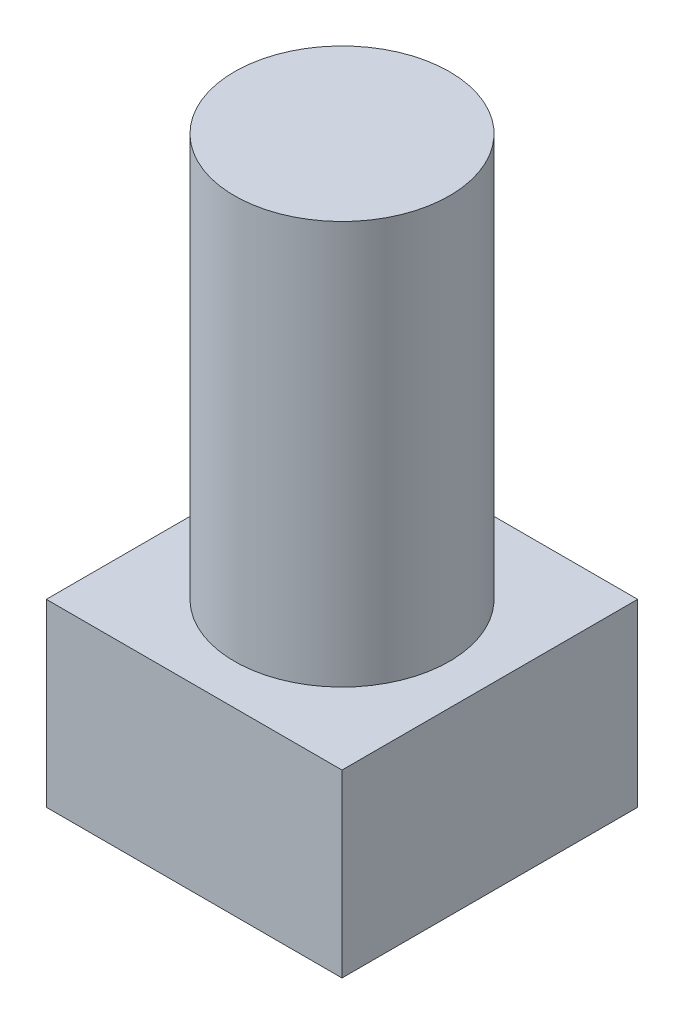
from build123d import *

# Parameters (mm, degrees)
ESQUISSE2_OUTSIDE_W     = 24.27
ESQUISSE2_OUTSIDE_H     = 24.27
ESQUISSE2_OUTSIDE_W_2   = 11
ESQUISSE2_OUTSIDE_H_2   = 11
ENL_V_MAT_EXTRU_1_DEPTH = 25.472229159
TROU_TARAUD_M41_D       = 3.3
TROU_TARAUD_M41_DEPTH   = 9
TROU_TARAUD_M41_TIP     = 0.991420021


with BuildPart() as part:
    # Esquisse1 → Révolution1 (revolve)
    with BuildSketch(Plane.XY, mode=Mode.PRIVATE) as r_volution1_sk:
        Polygon((0, 0), (8, 0), (8, 6.7), (4, 6.7), (4, 21.7), (0, 21.7), align=None)
    revolve(r_volution1_sk.sketch.rotate(Axis((0, 0, 0), (0, 1, 0)), 90), axis=Axis((0, 0, 0), (0, 1, 0)))

    # Esquisse2 outside → Enlèv. mat.-Extru.1 (cut, through all)
    with BuildSketch(Plane.XZ):
        Rectangle(ESQUISSE2_OUTSIDE_W, ESQUISSE2_OUTSIDE_H)
        Rectangle(ESQUISSE2_OUTSIDE_W_2, ESQUISSE2_OUTSIDE_H_2, mode=Mode.SUBTRACT)
    extrude(amount=-ENL_V_MAT_EXTRU_1_DEPTH, mode=Mode.SUBTRACT)

    # Trou taraudé M41
    with Locations(Plane.XZ):
        with Locations((0, 0)):
            Hole(TROU_TARAUD_M41_D / 2, depth=TROU_TARAUD_M41_DEPTH)
            with Locations((0, 0, -(TROU_TARAUD_M41_DEPTH + TROU_TARAUD_M41_TIP / 2))):  # 118° drill point
                Cone(0, TROU_TARAUD_M41_D / 2, TROU_TARAUD_M41_TIP, mode=Mode.SUBTRACT)


solid = part.part
